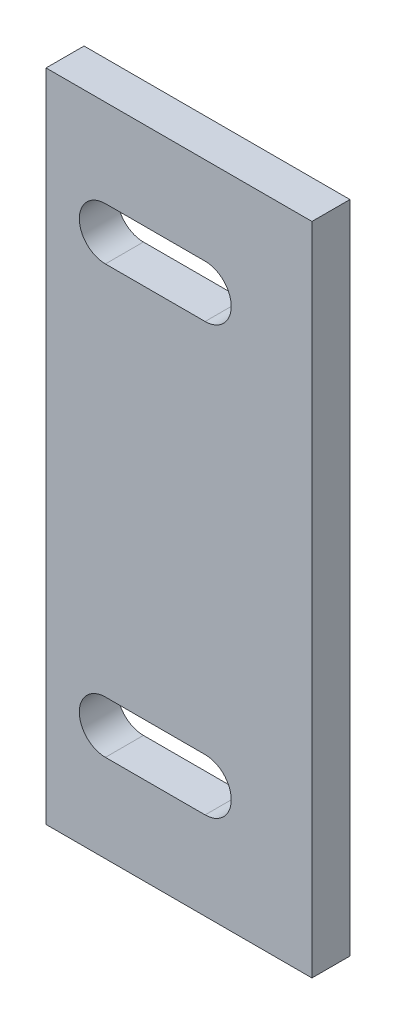
from build123d import *

# Parameters (mm, degrees)
SKETCH1_W           = 28
SKETCH1_H           = 69
BOSS_EXTRUDE1_DEPTH = 4


with BuildPart() as part:
    # Sketch1 → Boss-Extrude1 (new body)
    with BuildSketch(Plane.XY.offset(4)):
        with Locations((-14, 0)):
            Rectangle(SKETCH1_W, SKETCH1_H)
        with BuildLine():
            Line((-21.75, 25.25), (-11.25, 25.25))
            ThreePointArc((-11.25, 25.25), (-8.5, 22.5), (-11.25, 19.75))
            Line((-11.25, 19.75), (-21.75, 19.75))
            ThreePointArc((-21.75, 19.75), (-24.5, 22.5), (-21.75, 25.25))
        make_face(mode=Mode.SUBTRACT)
        with BuildLine():
            Line((-21.75, -19.75), (-11.25, -19.75))
            ThreePointArc((-11.25, -19.75), (-8.5, -22.5), (-11.25, -25.25))
            Line((-11.25, -25.25), (-21.75, -25.25))
            ThreePointArc((-21.75, -25.25), (-24.5, -22.5), (-21.75, -19.75))
        make_face(mode=Mode.SUBTRACT)
    extrude(amount=-BOSS_EXTRUDE1_DEPTH)


solid = part.part
